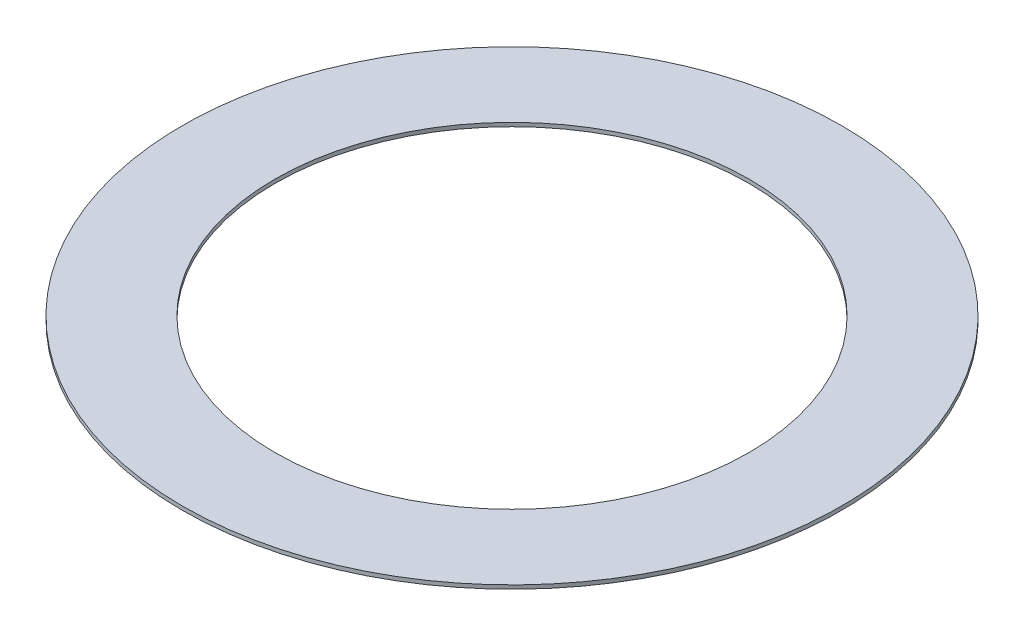
from build123d import *

# Parameters (mm, degrees)
SKETCH1_R           = 11.0744
SKETCH1_R_2         = 7.9629
BOSS_EXTRUDE1_DEPTH = 0.127


with BuildPart() as part:
    # Sketch1 → Boss-Extrude1 (new body)
    with BuildSketch(Plane(origin=(0, 0, 0), x_dir=(1, 0, 0), z_dir=(0, 1, 0))):
        with Locations(Location((0, 0, 0), (0, 0, 270))):
            Circle(SKETCH1_R)
        with Locations(Location((0, 0, 0), (0, 0, 270))):
            Circle(SKETCH1_R_2, mode=Mode.SUBTRACT)
    extrude(amount=BOSS_EXTRUDE1_DEPTH)


solid = part.part
